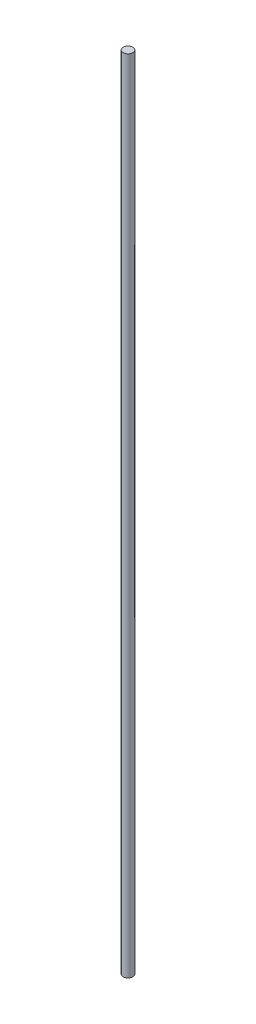
from build123d import *

# Parameters (mm, degrees)
SKETCH1_W = 0.75
SKETCH1_H = 125


with BuildPart() as part:
    # Sketch1 → Cuerdas_UHMWPE (revolve)
    with BuildSketch(Plane.XY, mode=Mode.PRIVATE) as cuerdas_uhmwpe_sk:
        with Locations((0.375, -98.5)):
            Rectangle(SKETCH1_W, SKETCH1_H)
    revolve(cuerdas_uhmwpe_sk.sketch.rotate(Axis((0, -165, 0), (0, 1, 0)), 90), axis=Axis((0, -165, 0), (0, 1, 0)))


solid = part.part
